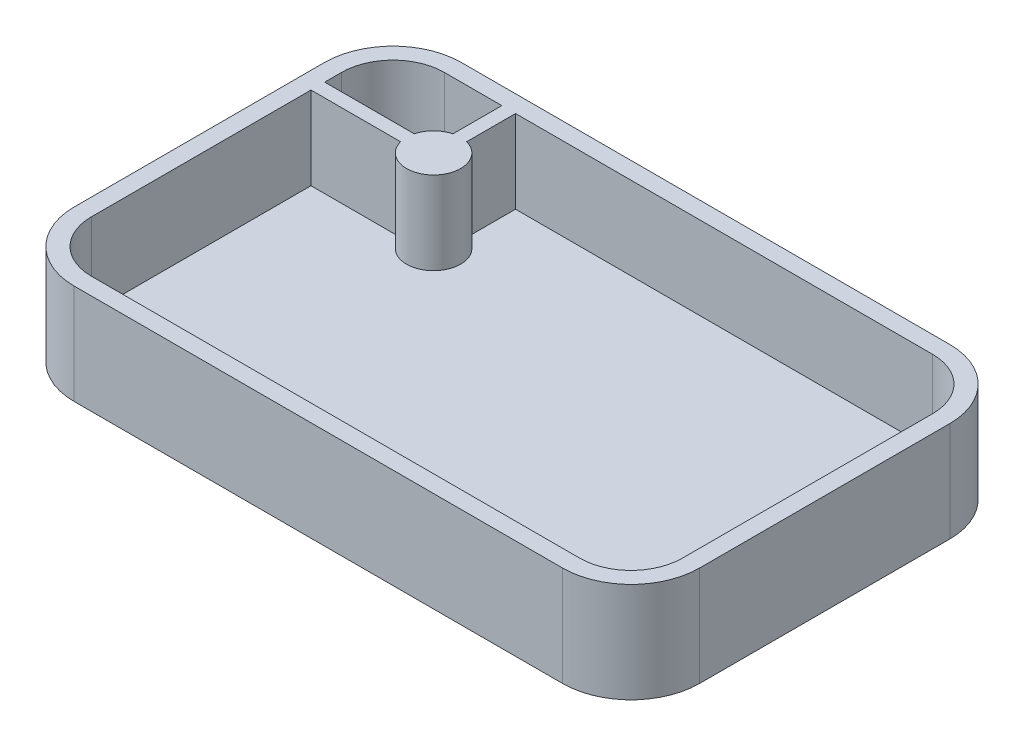
from build123d import *

# Parameters (mm, degrees)
BOSS_EXTRUDE1_DEPTH = 18.542
SHELL1_T            = -3.175
BOSS_EXTRUDE2_REACH = 139.638
SKETCH2_R           = 5.019286765
RIB1_REACH          = 139.638
SKETCH3_WALLS_W     = 293.719610529
SKETCH3_WALLS_H     = 2.54
SKETCH3_WALLS_W_2   = 2.54
SKETCH3_WALLS_H_2   = 286.179283193


with BuildPart() as part:
    # Sketch1 → Boss-Extrude1 (new body)
    with BuildSketch(Plane(origin=(0, 0, 0), x_dir=(1, 0, 0), z_dir=(0, 1, 0))):
        with BuildLine():
            Line((12.7, 0), (103.254058747, 0))
            ThreePointArc((103.254058747, 0), (112.234314868, 3.719743879), (115.954058747, 12.7))
            Line((115.954058747, 12.7), (115.954058747, 59.098953312))
            ThreePointArc((115.954058747, 59.098953312), (112.234314868, 68.079209433), (103.254058747, 71.798953312))
            Line((103.254058747, 71.798953312), (12.7, 71.798953312))
            ThreePointArc((12.7, 71.798953312), (3.719743879, 68.079209433), (0, 59.098953312))
            Line((0, 59.098953312), (0, 12.7))
            ThreePointArc((0, 12.7), (3.719743879, 3.719743879), (12.7, 0))
        make_face()
    extrude(amount=-BOSS_EXTRUDE1_DEPTH)

    # Shell1
    shell1_openings = [part.faces().sort_by_distance(p)[0] for p in [
        (57.977029373, 0, -35.899476656),
    ]]
    offset(amount=SHELL1_T, openings=shell1_openings, kind=Kind.INTERSECTION)

    # Sketch2 → Boss-Extrude2 (add, up to next)
    with BuildSketch(Plane(origin=(0, 0, 0), x_dir=(1, 0, 0), z_dir=(0, 1, 0)), mode=Mode.PRIVATE) as boss_extrude2_sk1:
        with Locations(Location((24.637750849, 54.7015298, 0), (0, 0, 270))):
            Circle(SKETCH2_R)
    boss_extrude2_tool1 = extrude(boss_extrude2_sk1.sketch, amount=-BOSS_EXTRUDE2_REACH, mode=Mode.PRIVATE) - part.part
    add(boss_extrude2_tool1.solids().sort_by_distance((24.637751, 0, -54.70153))[0])

    # Sketch3 walls → Rib1 (add, up to next)
    with BuildSketch(Plane(origin=(0, 0, 0), x_dir=(1, 0, 0), z_dir=(0, 1, 0)), mode=Mode.PRIVATE) as rib1_sk1:
        with Locations((11.396732042, 54.7015298)):
            Rectangle(SKETCH3_WALLS_W, SKETCH3_WALLS_H)
    rib1_tool1 = extrude(rib1_sk1.sketch, amount=-RIB1_REACH, mode=Mode.PRIVATE) - part.part
    # Sketch3 walls → Rib1 (add, up to next)
    with BuildSketch(Plane(origin=(0, 0, 0), x_dir=(1, 0, 0), z_dir=(0, 1, 0)), mode=Mode.PRIVATE) as rib1_sk2:
        with Locations((24.637750849, 64.172384939)):
            Rectangle(SKETCH3_WALLS_W_2, SKETCH3_WALLS_H_2)
    rib1_tool2 = extrude(rib1_sk2.sketch, amount=-RIB1_REACH, mode=Mode.PRIVATE) - part.part
    add(rib1_tool1.solids().sort_by_distance((11.396732042, 0, -54.7015298))[0])
    add(rib1_tool2.solids().sort_by_distance((24.637750849, 0, -64.172384939))[0])


solid = part.part
